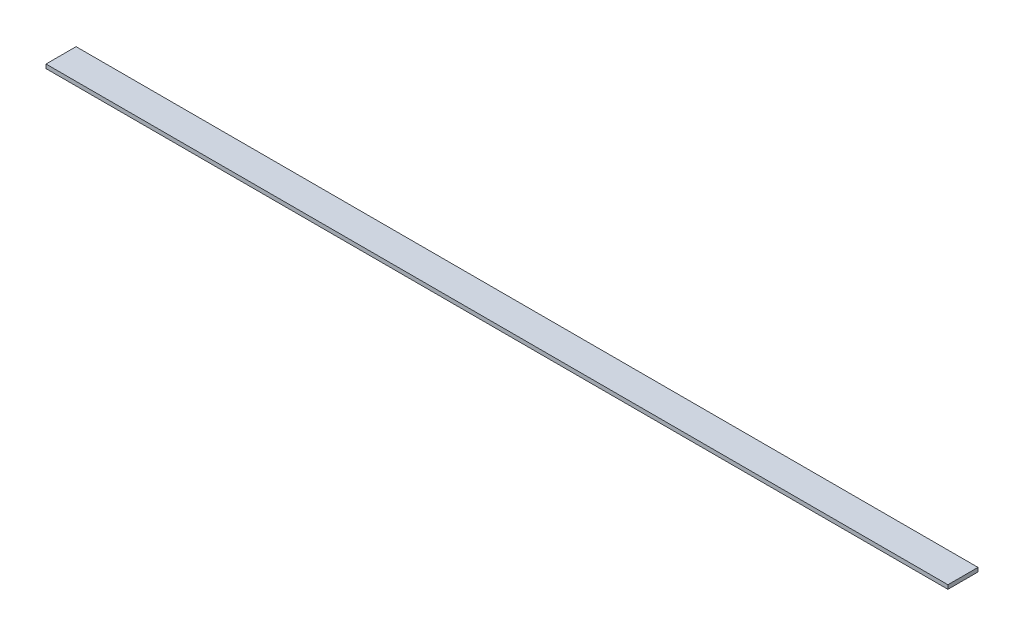
from build123d import *

# Parameters (mm, degrees)
SKETCH_1_W      = 4500
SKETCH_1_H      = 150
EXTRUDE_1_DEPTH = 20


with BuildPart() as part:
    # 草图1 → 凸台-拉伸1 (new body)
    with BuildSketch(Plane(origin=(0, 0, 0), x_dir=(1, 0, 0), z_dir=(0, 1, 0))):
        Rectangle(SKETCH_1_W, SKETCH_1_H)
    extrude(amount=EXTRUDE_1_DEPTH)


solid = part.part
